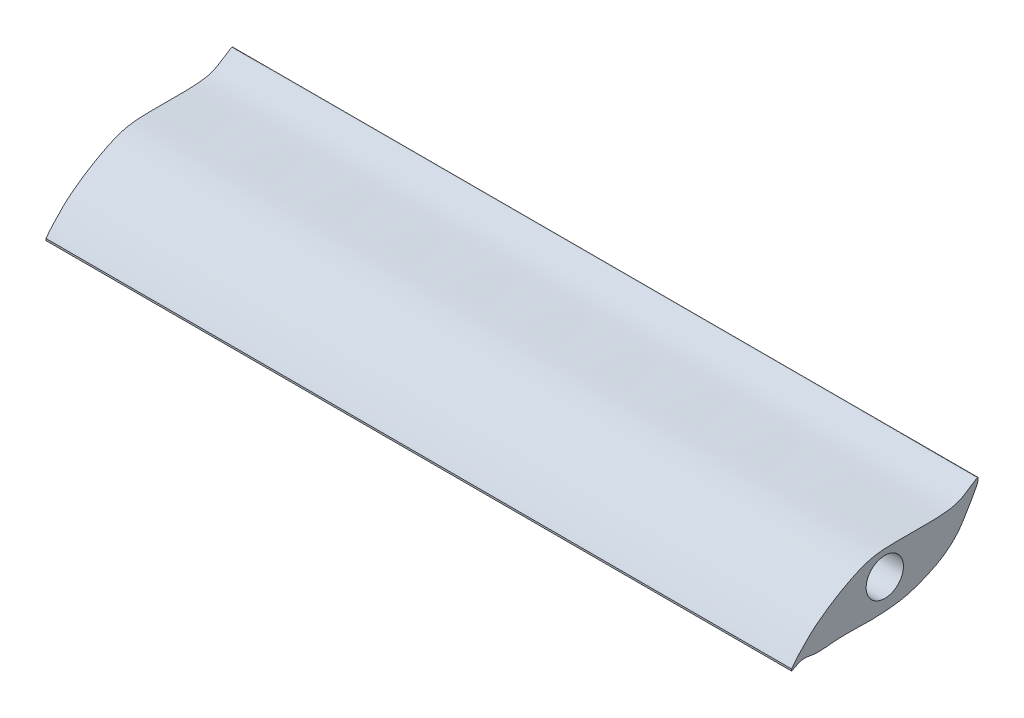
from build123d import *

# Parameters (mm, degrees)
SKETCH1_W           = 100
SKETCH1_H           = 25
BOSS_EXTRUDE1_DEPTH = 10
SKETCH2_R           = 2.5
CUT_EXTRUDE1_DEPTH  = 102.273145503
SKETCH3_OUTSIDE_W   = 47.712
SKETCH3_OUTSIDE_H   = 32.712
CUT_EXTRUDE2_DEPTH  = 102.273145503


with BuildPart() as part:
    # Sketch1 → Boss-Extrude1 (new body)
    with BuildSketch(Plane(origin=(0, 0, 0), x_dir=(1, 0, 0), z_dir=(0, 1, 0))):
        Rectangle(SKETCH1_W, SKETCH1_H)
    extrude(amount=BOSS_EXTRUDE1_DEPTH)

    # Sketch2 → Cut-Extrude1 (cut, through all)
    with BuildSketch(Plane(origin=(50, 0, 0), x_dir=(0, 0, -1), z_dir=(1, 0, 0))):
        with Locations((0, 4.687477838)):
            Circle(SKETCH2_R)
    extrude(amount=-CUT_EXTRUDE1_DEPTH, mode=Mode.SUBTRACT)

    # Sketch3 outside → Cut-Extrude2 (cut, through all)
    with BuildSketch(Plane(origin=(50, 0, 0), x_dir=(0, 0, -1), z_dir=(1, 0, 0))):
        with Locations((0, 5)):
            Rectangle(SKETCH3_OUTSIDE_W, SKETCH3_OUTSIDE_H)
        with BuildLine():
            add(Edge.make_bspline(
                [(-12.5, 0), (-12.962160843, -0.122781783), (-10.565001343, 2.574598069), (-9.088434897, 3.837316097), (-7.031050329, 5.320101196), (-4.746637635, 6.614496386), (-1.775241152, 7.984803811), (1.405616421, 8.026623643), (4.810554216, 8.022649388), (7.913171877, 8.000997945), (10.419121815, 8.510825969), (13.569920046, 11.13365552), (11.05339977, 6.851941676), (9.979186998, 5.063478678), (8.178067776, 3.293843651), (5.846481684, 2.057343993), (2.951373793, 0.955309651), (-0.192428753, 0.598462484), (-3.31005257, 0.565528176), (-6.424984489, 0.751781995), (-9.168639516, 0.217248552), (-11.11914774, 0.853496138), (-12.309571446, 0.050590953), (-12.5, 0)],
                knots=[0, 0, 0, 0, 0.054296524, 0.090617216, 0.128983232, 0.179185634, 0.230327239, 0.296649211, 0.341806293, 0.410135808, 0.451574591, 0.490256182, 0.547998222, 0.591214861, 0.624530717, 0.67324776, 0.729499513, 0.784649956, 0.837339854, 0.891975059, 0.948059427, 0.977627684, 1, 1, 1, 1], degree=3))
        make_face(mode=Mode.SUBTRACT)
    extrude(amount=-CUT_EXTRUDE2_DEPTH, mode=Mode.SUBTRACT)


solid = part.part
